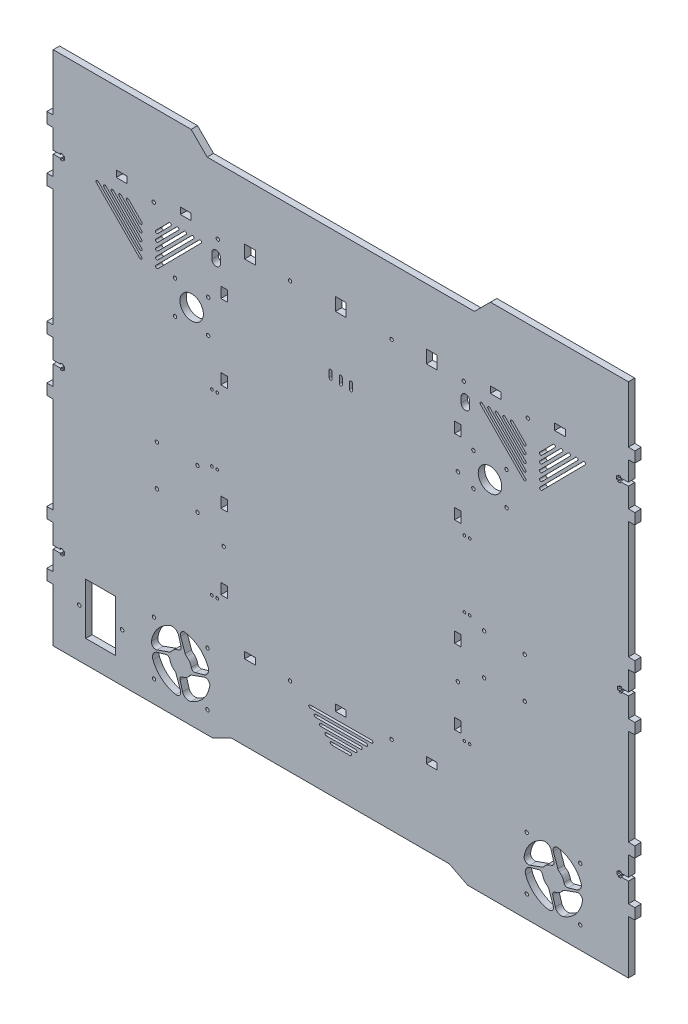
from build123d import *

# Parameters (mm, degrees)
SKETCH_1_R      = 1.6
SKETCH_1_R_2    = 11
SKETCH_1_R_3    = 1.65
SKETCH_1_R_4    = 1.25
SKETCH_1_W      = 10
SKETCH_1_H      = 12.1
SKETCH_1_H_2    = 6.1
SKETCH_1_W_2    = 28.000005
SKETCH_1_H_3    = 48
SKETCH_1_W_3    = 6.1
SKETCH_1_H_4    = 10
EXTRUDE_1_DEPTH = 6


with BuildPart() as part:
    # Эскиз1 → Бобышка-Вытянуть1 (new body)
    with BuildSketch(Plane.XY):
        Polygon((1048.755445299, 41.555928029), (1198.275289364, 41.555928029), (1215.275289364, 50.255928029), (1419.275289364, 50.255928029), (1436.275289364, 41.555928029), (1586.755445299, 41.555928029), (1586.755445299, 42.229895243), (1586.755445299, 91.455928029), (1592.755445299, 91.555920983), (1592.755445299, 101.564061487), (1586.755445299, 101.664059139), (1586.755445299, 120.014059139), (1579.955445299, 120.014059139), (1579.955445299, 118.814059139), (1577.755445299, 118.814059139), (1577.755445299, 120.014059139), (1576.255445299, 120.014059139), (1576.255445299, 123.114059139), (1577.755445299, 123.114059139), (1577.755445299, 124.314059139), (1579.955445299, 124.314059139), (1579.955445299, 123.114059139), (1586.755445299, 123.114059139), (1586.755445299, 141.464059139), (1592.755445299, 141.564052092), (1592.755445299, 151.572190055), (1586.755445299, 151.672187707), (1586.755445299, 241.472187707), (1592.755445299, 241.57218066), (1592.755445299, 251.580316084), (1586.755445299, 251.680313736), (1586.755445299, 270.030313736), (1580.435601234, 270.030313736), (1580.435601234, 268.830313736), (1578.235601234, 268.830313736), (1578.235601234, 270.030313736), (1576.735601234, 270.030313736), (1576.735601234, 273.130313736), (1578.235601234, 273.130313736), (1578.235601234, 274.330313736), (1580.435601234, 274.330313736), (1580.435601234, 273.130313736), (1586.755445299, 273.130313736), (1586.755445299, 291.44780454), (1592.755445299, 291.547797493), (1592.755445299, 301.555930378), (1586.755445299, 301.655928029), (1586.755445299, 411.455928029), (1592.755445299, 411.555920983), (1592.755445299, 421.555920983), (1586.755445299, 421.64840618), (1586.755445299, 440.010210156), (1586.047206734, 440.010210156), (1579.247206734, 440.010210156), (1579.247206734, 438.810210156), (1577.047206734, 438.810210156), (1577.047206734, 440.010210156), (1575.547206734, 440.010210156), (1575.547206734, 443.110210156), (1577.047206734, 443.110210156), (1577.047206734, 444.310210156), (1579.247206734, 444.310210156), (1579.247206734, 443.110210156), (1586.047206734, 443.110210156), (1586.755445299, 443.110210156), (1586.755445299, 461.472014132), (1592.755445299, 461.564485239), (1592.755445299, 471.555920983), (1586.755445299, 471.64840618), (1586.755445299, 524.555928029), (1457.755445299, 524.555928029), (1442.755445299, 509.555928029), (1192.755445299, 509.555928029), (1177.755445299, 524.555928029), (1048.755445299, 524.555928029), (1048.755445299, 471.655928029), (1042.755445299, 471.555928029), (1042.755445299, 461.555928029), (1048.755445299, 461.455928029), (1048.755445299, 443.105928029), (1055.555445299, 443.105928029), (1055.555445299, 444.305928029), (1057.755445299, 444.305928029), (1057.755445299, 443.105928029), (1059.255445299, 443.105928029), (1059.255445299, 440.005928029), (1057.755445299, 440.005928029), (1057.755445299, 438.805928029), (1055.555445299, 438.805928029), (1055.555445299, 440.005928029), (1048.755445299, 440.005928029), (1048.755445299, 421.655928029), (1042.755445299, 421.555928029), (1042.755445299, 411.555928029), (1048.755445299, 411.455928029), (1048.755445299, 301.655928029), (1042.755445299, 301.555928029), (1042.755445299, 291.555928029), (1048.755445299, 291.455928029), (1048.755445299, 273.105928029), (1055.555445299, 273.105928029), (1055.555445299, 274.305928029), (1057.755445299, 274.305928029), (1057.755445299, 273.105928029), (1059.255445299, 273.105928029), (1059.255445299, 270.005928029), (1057.755445299, 270.005928029), (1057.755445299, 268.805928029), (1055.555445299, 268.805928029), (1055.555445299, 270.005928029), (1048.755445299, 270.005928029), (1048.755445299, 251.655928029), (1042.755445299, 251.555928029), (1042.755445299, 241.555928029), (1048.755445299, 241.455928029), (1048.755445299, 151.655928029), (1042.755445299, 151.555928029), (1042.755445299, 141.555928029), (1048.755445299, 141.455928029), (1048.755445299, 123.105928029), (1055.555445299, 123.105928029), (1055.555445299, 124.305928029), (1057.755445299, 124.305928029), (1057.755445299, 123.105928029), (1059.255445299, 123.105928029), (1059.255445299, 120.005928029), (1057.755445299, 120.005928029), (1057.755445299, 118.805928029), (1055.555445299, 118.805928029), (1055.555445299, 120.005928029), (1048.755445299, 120.005928029), (1048.755445299, 101.655928029), (1042.755445299, 101.555928029), (1042.755445299, 91.555928029), (1048.755445299, 91.455928029), (1048.755445299, 42.225613117), align=None)
        with Locations((1193.706756289, 365.50723902)):
            Circle(SKETCH_1_R, mode=Mode.SUBTRACT)
        with Locations((1162.706756289, 365.50723902)):
            Circle(SKETCH_1_R, mode=Mode.SUBTRACT)
        with Locations((1178.206756289, 380.555928029)):
            Circle(SKETCH_1_R_2, mode=Mode.SUBTRACT)
        with Locations((1193.706756289, 396.50723902)):
            Circle(SKETCH_1_R, mode=Mode.SUBTRACT)
        with Locations((1202.755445299, 448.05723902)):
            Circle(SKETCH_1_R, mode=Mode.SUBTRACT)
        with Locations((1432.755445299, 448.05723902)):
            Circle(SKETCH_1_R, mode=Mode.SUBTRACT)
        with Locations((1365.255445299, 448.05723902)):
            Circle(SKETCH_1_R, mode=Mode.SUBTRACT)
        with Locations((1270.255445299, 448.05723902)):
            Circle(SKETCH_1_R, mode=Mode.SUBTRACT)
        with Locations((1162.706756289, 396.50723902)):
            Circle(SKETCH_1_R, mode=Mode.SUBTRACT)
        with Locations((1145.712920123, 217.273882543)):
            Circle(SKETCH_1_R, mode=Mode.SUBTRACT)
        with Locations((1365.255445299, 124.05491402)):
            Circle(SKETCH_1_R, mode=Mode.SUBTRACT)
        with Locations((1270.255445299, 124.05491402)):
            Circle(SKETCH_1_R, mode=Mode.SUBTRACT)
        with Locations((1492.755445299, 448.05723902)):
            Circle(SKETCH_1_R, mode=Mode.SUBTRACT)
        with Locations((1142.755445299, 448.05723902)):
            Circle(SKETCH_1_R, mode=Mode.SUBTRACT)
        with Locations((1073.162844871, 86.87758802)):
            Circle(SKETCH_1_R_3, mode=Mode.SUBTRACT)
        with Locations((1113.162844871, 86.87758802)):
            Circle(SKETCH_1_R_3, mode=Mode.SUBTRACT)
        with Locations((1145.712920123, 255.273882543)):
            Circle(SKETCH_1_R, mode=Mode.SUBTRACT)
        with Locations((1183.712920123, 217.273882543)):
            Circle(SKETCH_1_R, mode=Mode.SUBTRACT)
        with Locations((1183.712920123, 255.273882543)):
            Circle(SKETCH_1_R, mode=Mode.SUBTRACT)
        with Locations((1143.031783229, 112.012971893)):
            Circle(SKETCH_1_R, mode=Mode.SUBTRACT)
        with Locations((1143.031783229, 62.012971893)):
            Circle(SKETCH_1_R, mode=Mode.SUBTRACT)
        with Locations((1541.689341871, 112.012971893)):
            Circle(SKETCH_1_R, mode=Mode.SUBTRACT)
        with Locations((1541.689341871, 62.012971893)):
            Circle(SKETCH_1_R, mode=Mode.SUBTRACT)
        with Locations((1491.689341871, 112.012971893)):
            Circle(SKETCH_1_R, mode=Mode.SUBTRACT)
        with Locations((1491.689341871, 62.012971893)):
            Circle(SKETCH_1_R, mode=Mode.SUBTRACT)
        with Locations((1193.031783229, 62.012971893)):
            Circle(SKETCH_1_R, mode=Mode.SUBTRACT)
        with Locations((1193.031783229, 112.012971893)):
            Circle(SKETCH_1_R, mode=Mode.SUBTRACT)
        with Locations((1427.305445299, 371.90723902)):
            Circle(SKETCH_1_R, mode=Mode.SUBTRACT)
        with Locations((1427.305445299, 201.90723902)):
            Circle(SKETCH_1_R, mode=Mode.SUBTRACT)
        with Locations((1208.205445299, 201.90723902)):
            Circle(SKETCH_1_R, mode=Mode.SUBTRACT)
        with Locations((1202.195892293, 261.19163302)):
            Circle(SKETCH_1_R_4, mode=Mode.SUBTRACT)
        with Locations((1197.224537293, 261.25949102)):
            Circle(SKETCH_1_R_4, mode=Mode.SUBTRACT)
        with Locations((1202.158586293, 156.83802302)):
            Circle(SKETCH_1_R_4, mode=Mode.SUBTRACT)
        with Locations((1197.187231293, 156.90588202)):
            Circle(SKETCH_1_R_4, mode=Mode.SUBTRACT)
        with Locations((1438.308804299, 156.77016502)):
            Circle(SKETCH_1_R_4, mode=Mode.SUBTRACT)
        with Locations((1433.337449299, 156.83802402)):
            Circle(SKETCH_1_R_4, mode=Mode.SUBTRACT)
        with Locations(Location((1472.804134308, 365.50723902, 0), (0, 0, 180))):
            Circle(SKETCH_1_R, mode=Mode.SUBTRACT)
        with Locations((1438.346110299, 261.12377502)):
            Circle(SKETCH_1_R_4, mode=Mode.SUBTRACT)
        with Locations(Location((1441.804134308, 365.50723902, 0), (0, 0, 180))):
            Circle(SKETCH_1_R, mode=Mode.SUBTRACT)
        with Locations((1433.374755299, 261.19163302)):
            Circle(SKETCH_1_R_4, mode=Mode.SUBTRACT)
        with Locations(Location((1441.804134308, 396.50723902, 0), (0, 0, 180))):
            Circle(SKETCH_1_R, mode=Mode.SUBTRACT)
        with Locations((1438.326800299, 323.41350502)):
            Circle(SKETCH_1_R_4, mode=Mode.SUBTRACT)
        with Locations(Location((1457.304134308, 380.555928029, 0), (0, 0, 180))):
            Circle(SKETCH_1_R_2, mode=Mode.SUBTRACT)
        with Locations((1433.355445299, 323.48136302)):
            Circle(SKETCH_1_R_4, mode=Mode.SUBTRACT)
        with Locations(Location((1472.804134308, 396.50723902, 0), (0, 0, 180))):
            Circle(SKETCH_1_R, mode=Mode.SUBTRACT)
        with Locations(Location((1489.797970474, 217.273882543, 0), (0, 0, 180))):
            Circle(SKETCH_1_R, mode=Mode.SUBTRACT)
        with Locations(Location((1451.797970474, 217.273882543, 0), (0, 0, 180))):
            Circle(SKETCH_1_R, mode=Mode.SUBTRACT)
        with Locations(Location((1451.797970474, 255.273882543, 0), (0, 0, 180))):
            Circle(SKETCH_1_R, mode=Mode.SUBTRACT)
        with Locations(Location((1489.797970474, 255.273882543, 0), (0, 0, 180))):
            Circle(SKETCH_1_R, mode=Mode.SUBTRACT)
        with Locations((1202.176582293, 323.48136302)):
            Circle(SKETCH_1_R_4, mode=Mode.SUBTRACT)
        with Locations((1197.205227293, 323.54922102)):
            Circle(SKETCH_1_R_4, mode=Mode.SUBTRACT)
        with Locations((1402.755445299, 450.605928029)):
            Rectangle(SKETCH_1_W, SKETCH_1_H, mode=Mode.SUBTRACT)
        with BuildLine():
            Line((1197.155445299, 434.474322287), (1197.155445299, 429.191381807))
            ThreePointArc((1197.155445299, 429.191381807), (1198.327018174, 426.362954683), (1201.155445299, 425.191381807))
            ThreePointArc((1201.155445299, 425.191381807), (1203.983872423, 426.362954683), (1205.155445299, 429.191381807))
            Line((1205.155445299, 429.191381807), (1205.155445299, 434.474322287))
            ThreePointArc((1205.155445299, 434.474322287), (1203.983872423, 437.302749411), (1201.155445299, 438.474322287))
            ThreePointArc((1201.155445299, 438.474322287), (1198.327018174, 437.302749411), (1197.155445299, 434.474322287))
        make_face(mode=Mode.SUBTRACT)
        with BuildLine():
            Line((1503.96657517, 426.229073018), (1516.272389171, 438.671618019))
            ThreePointArc((1516.272389171, 438.671618019), (1518.040128671, 438.681384518), (1518.04989517, 436.913645018))
            Line((1518.04989517, 436.913645018), (1505.744081454, 424.471099305))
            ThreePointArc((1505.744081454, 424.471099305), (1503.976341456, 424.46133302), (1503.96657517, 426.229073018))
        make_face(mode=Mode.SUBTRACT)
        with BuildLine():
            Line((1546.33373517, 437.069909018), (1505.900345932, 396.187259778))
            ThreePointArc((1505.900345932, 396.187259778), (1504.132605931, 396.177493017), (1504.12283917, 397.945233018))
            Line((1504.12283917, 397.945233018), (1544.556229171, 438.827882019))
            ThreePointArc((1544.556229171, 438.827882019), (1546.323968671, 438.837648518), (1546.33373517, 437.069909018))
        make_face(mode=Mode.SUBTRACT)
        with Locations((1232.755445299, 450.605928029)):
            Rectangle(SKETCH_1_W, SKETCH_1_H, mode=Mode.SUBTRACT)
        with Locations((1317.755445299, 450.605928029)):
            Rectangle(SKETCH_1_W, SKETCH_1_H, mode=Mode.SUBTRACT)
        with BuildLine():
            Line((1525.12085517, 436.952711018), (1505.783147441, 417.400139292))
            ThreePointArc((1505.783147441, 417.400139292), (1504.015407443, 417.39037302), (1504.00564117, 419.158113018))
            Line((1504.00564117, 419.158113018), (1523.343349171, 438.710684019))
            ThreePointArc((1523.343349171, 438.710684019), (1525.111088671, 438.720450518), (1525.12085517, 436.952711018))
        make_face(mode=Mode.SUBTRACT)
        with BuildLine():
            Line((1504.08377317, 405.016193018), (1537.485269171, 438.788816019))
            ThreePointArc((1537.485269171, 438.788816019), (1539.253008671, 438.798582518), (1539.26277517, 437.030843018))
            Line((1539.26277517, 437.030843018), (1505.861280197, 403.258219046))
            ThreePointArc((1505.861280197, 403.258219046), (1504.093539698, 403.248452518), (1504.08377317, 405.016193018))
        make_face(mode=Mode.SUBTRACT)
        with Locations((1172.755445299, 453.605928029)):
            Rectangle(SKETCH_1_W, SKETCH_1_H_2, mode=Mode.SUBTRACT)
        with BuildLine():
            Line((1532.19181517, 436.991777018), (1505.822213435, 410.329179286))
            ThreePointArc((1505.822213435, 410.329179286), (1504.054473437, 410.31941302), (1504.04470717, 412.087153018))
            Line((1504.04470717, 412.087153018), (1530.414309171, 438.749750019))
            ThreePointArc((1530.414309171, 438.749750019), (1532.182048671, 438.759516518), (1532.19181517, 436.991777018))
        make_face(mode=Mode.SUBTRACT)
        with Locations((1462.755445299, 453.605928029)):
            Rectangle(SKETCH_1_W, SKETCH_1_H_2, mode=Mode.SUBTRACT)
        with BuildLine():
            Line((1131.388051427, 397.945233018), (1090.954661426, 438.827882019))
            ThreePointArc((1090.954661426, 438.827882019), (1089.186921926, 438.837648518), (1089.177155427, 437.069909018))
            Line((1089.177155427, 437.069909018), (1129.610544665, 396.187259778))
            ThreePointArc((1129.610544665, 396.187259778), (1131.378284666, 396.177493017), (1131.388051427, 397.945233018))
        make_face(mode=Mode.SUBTRACT)
        with BuildLine():
            Line((1096.248115427, 437.030843018), (1129.6496104, 403.258219046))
            ThreePointArc((1129.6496104, 403.258219046), (1131.417350899, 403.248452518), (1131.427117427, 405.016193018))
            Line((1131.427117427, 405.016193018), (1098.025621426, 438.788816019))
            ThreePointArc((1098.025621426, 438.788816019), (1096.257881926, 438.798582518), (1096.248115427, 437.030843018))
        make_face(mode=Mode.SUBTRACT)
        with BuildLine():
            Line((1131.466183427, 412.087153018), (1105.096581426, 438.749750019))
            ThreePointArc((1105.096581426, 438.749750019), (1103.328841926, 438.759516518), (1103.319075427, 436.991777018))
            Line((1103.319075427, 436.991777018), (1129.688677162, 410.329179286))
            ThreePointArc((1129.688677162, 410.329179286), (1131.45641716, 410.31941302), (1131.466183427, 412.087153018))
        make_face(mode=Mode.SUBTRACT)
        with BuildLine():
            Line((1131.505249427, 419.158113018), (1112.167541426, 438.710684019))
            ThreePointArc((1112.167541426, 438.710684019), (1110.399801926, 438.720450518), (1110.390035427, 436.952711018))
            Line((1110.390035427, 436.952711018), (1129.727743156, 417.400139292))
            ThreePointArc((1129.727743156, 417.400139292), (1131.495483154, 417.39037302), (1131.505249427, 419.158113018))
        make_face(mode=Mode.SUBTRACT)
        with BuildLine():
            Line((1131.544315427, 426.229073018), (1119.238501426, 438.671618019))
            ThreePointArc((1119.238501426, 438.671618019), (1117.470761926, 438.681384518), (1117.460995427, 436.913645018))
            Line((1117.460995427, 436.913645018), (1129.766809143, 424.471099305))
            ThreePointArc((1129.766809143, 424.471099305), (1131.534549141, 424.46133302), (1131.544315427, 426.229073018))
        make_face(mode=Mode.SUBTRACT)
        with BuildLine():
            Line((1144.920952759, 397.945233486), (1185.354342039, 438.827882757))
            ThreePointArc((1185.354342039, 438.827882757), (1187.122082038, 438.837649018), (1187.131848299, 437.06990902))
            Line((1187.131848299, 437.06990902), (1146.698459299, 396.18726002))
            ThreePointArc((1146.698459299, 396.18726002), (1144.930719296, 396.177493483), (1144.920952759, 397.945233486))
        make_face(mode=Mode.SUBTRACT)
        with Locations((1402.755445299, 123.605928029)):
            Rectangle(SKETCH_1_W, SKETCH_1_H_2, mode=Mode.SUBTRACT)
        with Locations((1317.755445299, 123.605928029)):
            Rectangle(SKETCH_1_W, SKETCH_1_H_2, mode=Mode.SUBTRACT)
        with Locations((1232.755445299, 123.605928029)):
            Rectangle(SKETCH_1_W, SKETCH_1_H_2, mode=Mode.SUBTRACT)
        with Locations((1093.162846371, 86.87758802)):
            Rectangle(SKETCH_1_W_2, SKETCH_1_H_3, mode=Mode.SUBTRACT)
        with BuildLine():
            Line((1455.450001299, 437.03084302), (1488.851497299, 403.25822002))
            ThreePointArc((1488.851497299, 403.25822002), (1490.619237301, 403.248453504), (1490.629003817, 405.016193507))
            Line((1490.629003817, 405.016193507), (1457.22750805, 438.788816271))
            ThreePointArc((1457.22750805, 438.788816271), (1455.459768049, 438.798583021), (1455.450001299, 437.03084302))
        make_face(mode=Mode.SUBTRACT)
        with BuildLine():
            Line((1144.88188678, 405.016193507), (1178.283382547, 438.788816271))
            ThreePointArc((1178.283382547, 438.788816271), (1180.051122548, 438.798583021), (1180.060889299, 437.03084302))
            Line((1180.060889299, 437.03084302), (1146.659393299, 403.25822002))
            ThreePointArc((1146.659393299, 403.25822002), (1144.891653296, 403.248453504), (1144.88188678, 405.016193507))
        make_face(mode=Mode.SUBTRACT)
        with BuildLine():
            Line((1172.989929299, 436.99177702), (1146.620327299, 410.32917902))
            ThreePointArc((1146.620327299, 410.32917902), (1144.852586799, 410.319412517), (1144.842820296, 412.087153017))
            Line((1144.842820296, 412.087153017), (1171.212422547, 438.749750271))
            ThreePointArc((1171.212422547, 438.749750271), (1172.980162548, 438.759517021), (1172.989929299, 436.99177702))
        make_face(mode=Mode.SUBTRACT)
        with BuildLine():
            Line((1144.803754296, 419.158113017), (1164.141462547, 438.710684271))
            ThreePointArc((1164.141462547, 438.710684271), (1165.909202548, 438.720451021), (1165.918969299, 436.95271102))
            Line((1165.918969299, 436.95271102), (1146.581261299, 417.40013902))
            ThreePointArc((1146.581261299, 417.40013902), (1144.813520799, 417.390372517), (1144.803754296, 419.158113017))
        make_face(mode=Mode.SUBTRACT)
        with BuildLine():
            Line((1158.848009299, 436.91364502), (1146.542195299, 424.47109902))
            ThreePointArc((1146.542195299, 424.47109902), (1144.774454799, 424.461332517), (1144.764688295, 426.229073017))
            Line((1144.764688295, 426.229073017), (1157.070502547, 438.671618271))
            ThreePointArc((1157.070502547, 438.671618271), (1158.838242548, 438.681385021), (1158.848009299, 436.91364502))
        make_face(mode=Mode.SUBTRACT)
        with BuildLine():
            Line((1430.355445299, 429.191381807), (1430.355445299, 434.474322287))
            ThreePointArc((1430.355445299, 434.474322287), (1431.527018174, 437.302749411), (1434.355445299, 438.474322287))
            ThreePointArc((1434.355445299, 438.474322287), (1437.183872423, 437.302749411), (1438.355445299, 434.474322287))
            Line((1438.355445299, 434.474322287), (1438.355445299, 429.191381807))
            ThreePointArc((1438.355445299, 429.191381807), (1437.183872423, 426.362954683), (1434.355445299, 425.191381807))
            ThreePointArc((1434.355445299, 425.191381807), (1431.527018174, 426.362954683), (1430.355445299, 429.191381807))
        make_face(mode=Mode.SUBTRACT)
        with BuildLine():
            Line((1326.629180083, 91.617684324), (1309.129447611, 91.521000907))
            ThreePointArc((1309.129447611, 91.521000907), (1307.872560358, 92.764075536), (1309.115634987, 94.020962789))
            Line((1309.115634987, 94.020962789), (1326.615368167, 94.1176455))
            ThreePointArc((1326.615368167, 94.1176455), (1327.872254713, 92.87457087), (1326.629180083, 91.617684324))
        make_face(mode=Mode.SUBTRACT)
        with BuildLine():
            Line((1331.601480015, 96.645231923), (1304.101899305, 96.493300132))
            ThreePointArc((1304.101899305, 96.493300132), (1302.845012759, 97.736375468), (1304.088088096, 98.993262014))
            Line((1304.088088096, 98.993262014), (1331.587668099, 99.145193099))
            ThreePointArc((1331.587668099, 99.145193099), (1332.844554645, 97.902118469), (1331.601480015, 96.645231923))
        make_face(mode=Mode.SUBTRACT)
        with BuildLine():
            Line((1336.573779947, 101.672779522), (1299.074351706, 101.465600064))
            ThreePointArc((1299.074351706, 101.465600064), (1297.81746516, 102.7086754), (1299.060540497, 103.965561946))
            Line((1299.060540497, 103.965561946), (1336.559967324, 104.172741405))
            ThreePointArc((1336.559967324, 104.172741405), (1337.816854577, 102.929666775), (1336.573779947, 101.672779522))
        make_face(mode=Mode.SUBTRACT)
        with BuildLine():
            Line((1289.005445299, 113.91016181), (1346.504567188, 114.227836603))
            ThreePointArc((1346.504567188, 114.227836603), (1347.761454441, 112.984761973), (1346.518379811, 111.72787472))
            Line((1346.518379811, 111.72787472), (1289.019256508, 111.410199928))
            ThreePointArc((1289.019256508, 111.410199928), (1287.762369962, 112.653275264), (1289.005445299, 113.91016181))
        make_face(mode=Mode.SUBTRACT)
        with BuildLine():
            Line((1341.546079879, 106.700327121), (1294.046804107, 106.437899996))
            ThreePointArc((1294.046804107, 106.437899996), (1292.789917561, 107.680975332), (1294.032992898, 108.937861878))
            Line((1294.032992898, 108.937861878), (1341.532267256, 109.200289004))
            ThreePointArc((1341.532267256, 109.200289004), (1342.789154509, 107.957214374), (1341.546079879, 106.700327121))
        make_face(mode=Mode.SUBTRACT)
        with BuildLine():
            Line((1448.379042299, 437.06990902), (1488.812431299, 396.18726002))
            ThreePointArc((1488.812431299, 396.18726002), (1490.580171301, 396.177493483), (1490.589937838, 397.945233486))
            Line((1490.589937838, 397.945233486), (1450.156548558, 438.827882757))
            ThreePointArc((1450.156548558, 438.827882757), (1448.388808559, 438.837649018), (1448.379042299, 437.06990902))
        make_face(mode=Mode.SUBTRACT)
        with BuildLine():
            Line((1469.591921299, 436.95271102), (1488.929629299, 417.40013902))
            ThreePointArc((1488.929629299, 417.40013902), (1490.697369798, 417.390372517), (1490.707136301, 419.158113017))
            Line((1490.707136301, 419.158113017), (1471.36942805, 438.710684271))
            ThreePointArc((1471.36942805, 438.710684271), (1469.601688049, 438.720451021), (1469.591921299, 436.95271102))
        make_face(mode=Mode.SUBTRACT)
        with BuildLine():
            Line((1476.662881299, 436.91364502), (1488.968695299, 424.47109902))
            ThreePointArc((1488.968695299, 424.47109902), (1490.736435798, 424.461332517), (1490.746202302, 426.229073017))
            Line((1490.746202302, 426.229073017), (1478.44038805, 438.671618271))
            ThreePointArc((1478.44038805, 438.671618271), (1476.672648049, 438.681385021), (1476.662881299, 436.91364502))
        make_face(mode=Mode.SUBTRACT)
        with BuildLine():
            Line((1462.520961299, 436.99177702), (1488.890563299, 410.32917902))
            ThreePointArc((1488.890563299, 410.32917902), (1490.658303798, 410.319412517), (1490.668070301, 412.087153017))
            Line((1490.668070301, 412.087153017), (1464.29846805, 438.749750271))
            ThreePointArc((1464.29846805, 438.749750271), (1462.530728049, 438.759517021), (1462.520961299, 436.99177702))
        make_face(mode=Mode.SUBTRACT)
        with BuildLine():
            Line((1530.317428095, 86.376861737), (1538.475232454, 88.733710728))
            ThreePointArc((1538.475232454, 88.733710728), (1542.17332586, 91.808427073), (1542.425449513, 96.611156411))
            ThreePointArc((1542.425449513, 96.611156411), (1534.073793622, 108.256420171), (1521.01322148, 114.154197673))
            ThreePointArc((1521.01322148, 114.154197673), (1517.29590567, 112.767766584), (1516.60124357, 108.861608297))
            Line((1516.60124357, 108.861608297), (1520.758003302, 97.218443933))
            ThreePointArc((1520.758003302, 97.218443933), (1521.358855676, 96.119028752), (1522.270346342, 95.259422982))
            ThreePointArc((1522.270346342, 95.259422982), (1525.056734388, 92.412613), (1526.534776336, 88.713467502))
            ThreePointArc((1526.534776336, 88.713467502), (1527.908153618, 86.706675217), (1530.317428095, 86.376861737))
        make_face(mode=Mode.SUBTRACT)
        with BuildLine():
            Line((1494.55707538, 86.909353323), (1506.20023984, 91.066114192))
            ThreePointArc((1506.20023984, 91.066114192), (1507.29965486, 91.666966573), (1508.159260507, 92.578457166))
            ThreePointArc((1508.159260507, 92.578457166), (1511.006070681, 95.364845404), (1514.70521647, 96.842887354))
            ThreePointArc((1514.70521647, 96.842887354), (1516.712008813, 98.216264561), (1517.041822384, 100.625539031))
            Line((1517.041822384, 100.625539031), (1514.684973929, 108.783342647))
            ThreePointArc((1514.684973929, 108.783342647), (1511.610257778, 112.481436135), (1506.807528513, 112.73356004))
            ThreePointArc((1506.807528513, 112.73356004), (1495.162263635, 104.381904059), (1489.264485679, 91.321331066))
            ThreePointArc((1489.264485679, 91.321331066), (1490.650916926, 87.604015185), (1494.55707538, 86.909353323))
        make_face(mode=Mode.SUBTRACT)
        with BuildLine():
            Line((1502.766409655, 87.3542366), (1494.608606517, 84.997388283))
            ThreePointArc((1494.608606517, 84.997388283), (1490.910512973, 81.92267202), (1490.658389213, 77.119942632))
            ThreePointArc((1490.658389213, 77.119942632), (1499.010045139, 65.474678548), (1512.070617536, 59.576900922))
            ThreePointArc((1512.070617536, 59.576900922), (1515.787933469, 60.963332183), (1516.482595285, 64.869490698))
            Line((1516.482595285, 64.869490698), (1512.325834508, 76.512654108))
            ThreePointArc((1512.325834508, 76.512654108), (1511.724982125, 77.612069087), (1510.813491551, 78.471674702))
            ThreePointArc((1510.813491551, 78.471674702), (1508.027103292, 81.318484881), (1506.549061331, 85.017630686))
            ThreePointArc((1506.549061331, 85.017630686), (1505.175684124, 87.024423029), (1502.766409655, 87.3542366))
        make_face(mode=Mode.SUBTRACT)
        with BuildLine():
            Line((1538.537978168, 86.806225385), (1526.894813708, 82.649464517))
            ThreePointArc((1526.894813708, 82.649464517), (1525.795398688, 82.048612136), (1524.935793041, 81.137121543))
            ThreePointArc((1524.935793041, 81.137121543), (1522.088983162, 78.350733496), (1518.389837768, 76.872691482))
            ThreePointArc((1518.389837768, 76.872691482), (1516.383045574, 75.499314225), (1516.053232058, 73.090039843))
            Line((1516.053232058, 73.090039843), (1518.410080468, 64.932236381))
            ThreePointArc((1518.410080468, 64.932236381), (1521.484796731, 61.234142837), (1526.287526119, 60.982019077))
            ThreePointArc((1526.287526119, 60.982019077), (1537.932790281, 69.333675098), (1543.830567869, 82.394247642))
            ThreePointArc((1543.830567869, 82.394247642), (1542.444136622, 86.111563523), (1538.537978168, 86.806225385))
        make_face(mode=Mode.SUBTRACT)
        with Locations((1522.755445299, 453.605928029)):
            Rectangle(SKETCH_1_W, SKETCH_1_H_2, mode=Mode.SUBTRACT)
        with Locations((1112.755445299, 453.605928029)):
            Rectangle(SKETCH_1_W, SKETCH_1_H_2, mode=Mode.SUBTRACT)
        with BuildLine():
            Line((1167.825036644, 64.869490698), (1163.668275867, 76.512654108))
            ThreePointArc((1163.668275867, 76.512654108), (1163.067423484, 77.612069087), (1162.155932909, 78.471674702))
            ThreePointArc((1162.155932909, 78.471674702), (1159.36954465, 81.318484881), (1157.89150269, 85.017630686))
            ThreePointArc((1157.89150269, 85.017630686), (1156.518125483, 87.024423029), (1154.108851013, 87.3542366))
            Line((1154.108851013, 87.3542366), (1145.951047876, 84.997388283))
            ThreePointArc((1145.951047876, 84.997388283), (1142.252954332, 81.92267202), (1142.000830572, 77.119942632))
            ThreePointArc((1142.000830572, 77.119942632), (1150.352486498, 65.474678548), (1163.413058895, 59.576900922))
            ThreePointArc((1163.413058895, 59.576900922), (1167.130374827, 60.963332183), (1167.825036644, 64.869490698))
        make_face(mode=Mode.SUBTRACT)
        with Locations((1427.305445299, 406.455928029)):
            Rectangle(SKETCH_1_W_3, SKETCH_1_H_4, mode=Mode.SUBTRACT)
        with Locations((1427.305445299, 336.455928029)):
            Rectangle(SKETCH_1_W_3, SKETCH_1_H_4, mode=Mode.SUBTRACT)
        with Locations((1427.305445299, 236.455928029)):
            Rectangle(SKETCH_1_W_3, SKETCH_1_H_4, mode=Mode.SUBTRACT)
        with Locations((1427.305445299, 166.455928029)):
            Rectangle(SKETCH_1_W_3, SKETCH_1_H_4, mode=Mode.SUBTRACT)
        with Locations((1208.625445299, 166.455928029)):
            Rectangle(SKETCH_1_W_3, SKETCH_1_H_4, mode=Mode.SUBTRACT)
        with Locations((1208.625445299, 236.455928029)):
            Rectangle(SKETCH_1_W_3, SKETCH_1_H_4, mode=Mode.SUBTRACT)
        with Locations((1208.625445299, 336.455928029)):
            Rectangle(SKETCH_1_W_3, SKETCH_1_H_4, mode=Mode.SUBTRACT)
        with Locations((1208.625445299, 406.455928029)):
            Rectangle(SKETCH_1_W_3, SKETCH_1_H_4, mode=Mode.SUBTRACT)
        with BuildLine():
            Line((1145.899516738, 86.909353323), (1157.542681199, 91.066114192))
            ThreePointArc((1157.542681199, 91.066114192), (1158.642096219, 91.666966573), (1159.501701866, 92.578457166))
            ThreePointArc((1159.501701866, 92.578457166), (1162.348512039, 95.364845404), (1166.047657828, 96.842887354))
            ThreePointArc((1166.047657828, 96.842887354), (1168.054450172, 98.216264561), (1168.384263743, 100.625539031))
            Line((1168.384263743, 100.625539031), (1166.027415288, 108.783342647))
            ThreePointArc((1166.027415288, 108.783342647), (1162.952699137, 112.481436135), (1158.149969872, 112.73356004))
            ThreePointArc((1158.149969872, 112.73356004), (1146.504704993, 104.381904059), (1140.606927038, 91.321331066))
            ThreePointArc((1140.606927038, 91.321331066), (1141.993358285, 87.604015185), (1145.899516738, 86.909353323))
        make_face(mode=Mode.SUBTRACT)
        with BuildLine():
            Line((1189.880419527, 86.806225385), (1178.237255066, 82.649464517))
            ThreePointArc((1178.237255066, 82.649464517), (1177.137840046, 82.048612136), (1176.2782344, 81.137121543))
            ThreePointArc((1176.2782344, 81.137121543), (1173.43142452, 78.350733496), (1169.732279127, 76.872691482))
            ThreePointArc((1169.732279127, 76.872691482), (1167.725486933, 75.499314225), (1167.395673416, 73.090039843))
            Line((1167.395673416, 73.090039843), (1169.752521827, 64.932236381))
            ThreePointArc((1169.752521827, 64.932236381), (1172.82723809, 61.234142837), (1177.629967478, 60.982019077))
            ThreePointArc((1177.629967478, 60.982019077), (1189.275231639, 69.333675098), (1195.173009228, 82.394247642))
            ThreePointArc((1195.173009228, 82.394247642), (1193.78657798, 86.111563523), (1189.880419527, 86.806225385))
        make_face(mode=Mode.SUBTRACT)
        with BuildLine():
            Line((1181.659869454, 86.376861737), (1189.817673812, 88.733710728))
            ThreePointArc((1189.817673812, 88.733710728), (1193.515767218, 91.808427073), (1193.767890872, 96.611156411))
            ThreePointArc((1193.767890872, 96.611156411), (1185.416234981, 108.256420171), (1172.355662838, 114.154197673))
            ThreePointArc((1172.355662838, 114.154197673), (1168.638347028, 112.767766584), (1167.943684929, 108.861608297))
            Line((1167.943684929, 108.861608297), (1172.100444661, 97.218443933))
            ThreePointArc((1172.100444661, 97.218443933), (1172.701297034, 96.119028752), (1173.6127877, 95.259422982))
            ThreePointArc((1173.6127877, 95.259422982), (1176.399175747, 92.412613), (1177.877217694, 88.713467502))
            ThreePointArc((1177.877217694, 88.713467502), (1179.250594977, 86.706675217), (1181.659869454, 86.376861737))
        make_face(mode=Mode.SUBTRACT)
        with BuildLine():
            Line((1325.855445299, 394.044239538), (1325.855445299, 388.044239538))
            ThreePointArc((1325.855445299, 388.044239538), (1327.255445299, 386.644239538), (1328.655445299, 388.044239538))
            Line((1328.655445299, 388.044239538), (1328.655445299, 394.044239538))
            ThreePointArc((1328.655445299, 394.044239538), (1327.255445299, 395.444239538), (1325.855445299, 394.044239538))
        make_face(mode=Mode.SUBTRACT)
        with BuildLine():
            Line((1316.355445299, 394.044239538), (1316.355445299, 388.044239538))
            ThreePointArc((1316.355445299, 388.044239538), (1317.755445299, 386.644239538), (1319.155445299, 388.044239538))
            Line((1319.155445299, 388.044239538), (1319.155445299, 394.044239538))
            ThreePointArc((1319.155445299, 394.044239538), (1317.755445299, 395.444239538), (1316.355445299, 394.044239538))
        make_face(mode=Mode.SUBTRACT)
        with BuildLine():
            Line((1306.855445299, 394.044239538), (1306.855445299, 388.044239538))
            ThreePointArc((1306.855445299, 388.044239538), (1308.255445299, 386.644239538), (1309.655445299, 388.044239538))
            Line((1309.655445299, 388.044239538), (1309.655445299, 394.044239538))
            ThreePointArc((1309.655445299, 394.044239538), (1308.255445299, 395.444239538), (1306.855445299, 394.044239538))
        make_face(mode=Mode.SUBTRACT)
    extrude(amount=-EXTRUDE_1_DEPTH)


solid = part.part
